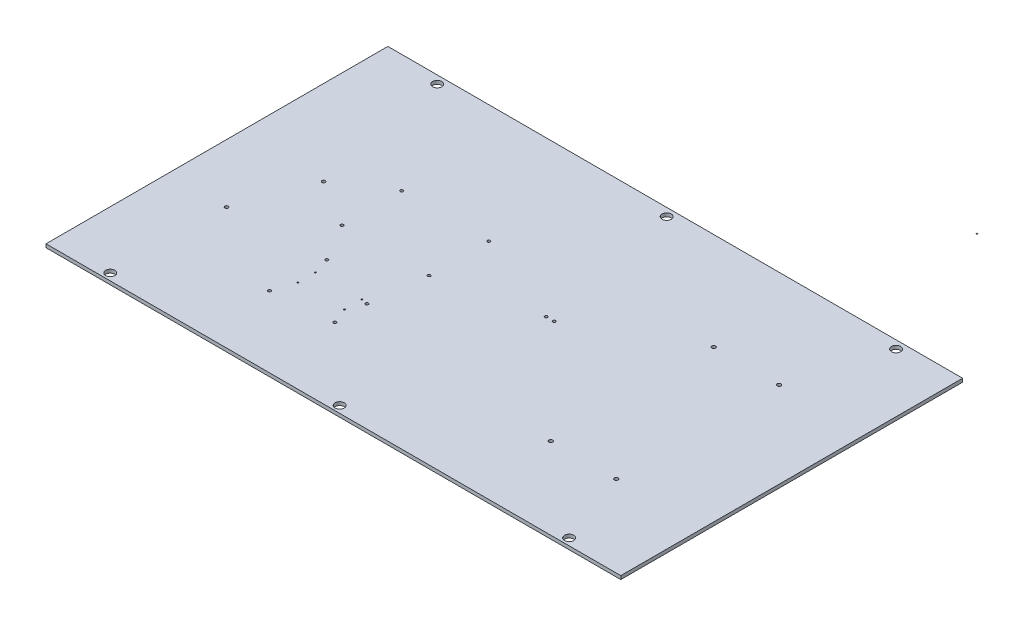
from build123d import *

# Parameters (mm, degrees)
SKETCH1_W                         = 1.001
SKETCH1_H                         = 1.001
SKETCH1_W_2                       = 0.001
SKETCH1_H_2                       = 0.001
EXTRUDE_THIN5_DEPTH               = 0.01
SKETCH2_W                         = 501
SKETCH2_H                         = 298
BOSS_EXTRUDE2_DEPTH               = 3
SKETCH35_W                        = 1.25
SKETCH35_H                        = 3
M3X0_5_TAPPED_HOLE3_AT_2_COUNT    = 2
M3X0_5_TAPPED_HOLE3_AT_2_PITCH    = 76
M3X0_5_TAPPED_HOLE3_AT_3_COUNT    = 2
M3X0_5_TAPPED_HOLE3_AT_3_PITCH    = 92.086915466
M3X0_5_TAPPED_HOLE3_AT_4_COUNT    = 2
M3X0_5_TAPPED_HOLE3_AT_4_PITCH    = 52
SKETCH37_W                        = 1.25
SKETCH37_H                        = 3
M3X0_5_TAPPED_HOLE2_AT_2_COUNT    = 2
M3X0_5_TAPPED_HOLE2_AT_2_PITCH    = 53.075229627
M3X0_5_TAPPED_HOLE2_AT_3_COUNT    = 2
M3X0_5_TAPPED_HOLE2_AT_3_PITCH    = 48.29
M3X0_5_TAPPED_HOLE2_AT_4_COUNT    = 2
M3X0_5_TAPPED_HOLE2_AT_4_PITCH    = 66.894989349
SKETCH39_W                        = 1.65
SKETCH39_H                        = 3
M4X0_7_TAPPED_HOLE1_AT_2_COUNT    = 2
M4X0_7_TAPPED_HOLE1_AT_2_PITCH    = 57
M4X0_7_TAPPED_HOLE1_AT_3_COUNT    = 2
M4X0_7_TAPPED_HOLE1_AT_3_PITCH    = 153.013071337
M4X0_7_TAPPED_HOLE1_AT_4_COUNT    = 2
M4X0_7_TAPPED_HOLE1_AT_4_PITCH    = 142
SKETCH40_W                        = 0.625
SKETCH40_H                        = 3
M1_6X0_35_TAPPED_HOLE1_AT_2_COUNT = 2
M1_6X0_35_TAPPED_HOLE1_AT_2_PITCH = 40.64
M1_6X0_35_TAPPED_HOLE1_AT_3_COUNT = 2
M1_6X0_35_TAPPED_HOLE1_AT_3_PITCH = 43.403539026
M1_6X0_35_TAPPED_HOLE1_AT_4_COUNT = 2
M1_6X0_35_TAPPED_HOLE1_AT_4_PITCH = 15.24
SKETCH42_W                        = 1.25
SKETCH42_H                        = 3
M3X0_5_TAPPED_HOLE1_AT_2_COUNT    = 2
M3X0_5_TAPPED_HOLE1_AT_2_PITCH    = 7
SKETCH49_W                        = 1.45
SKETCH49_H                        = 3
M3_5X0_6_TAPPED_HOLE1_AT_2_COUNT  = 2
M3_5X0_6_TAPPED_HOLE1_AT_2_PITCH  = 65.753783161
SKETCH55_W                        = 4
SKETCH55_H                        = 3.01
F_8_0MM_DOWEL_HOLE1_AT_2_COUNT    = 2
F_8_0MM_DOWEL_HOLE1_AT_2_PITCH    = 200
F_8_0MM_DOWEL_HOLE1_AT_3_COUNT    = 2
F_8_0MM_DOWEL_HOLE1_AT_3_PITCH    = 400
F_8_0MM_DOWEL_HOLE1_AT_4_COUNT    = 2
F_8_0MM_DOWEL_HOLE1_AT_4_PITCH    = 491.14661762
F_8_0MM_DOWEL_HOLE1_AT_5_COUNT    = 2
F_8_0MM_DOWEL_HOLE1_AT_5_PITCH    = 348.173807171
F_8_0MM_DOWEL_HOLE1_AT_6_COUNT    = 2
F_8_0MM_DOWEL_HOLE1_AT_6_PITCH    = 285


with BuildPart() as part:
    # Sketch1 → Extrude-Thin5 (new body)
    with BuildSketch(Plane(origin=(0, 0, 0), x_dir=(1, 0, 0), z_dir=(0, 1, 0))):
        with Locations((200.0005, 249.9995)):
            Rectangle(SKETCH1_W, SKETCH1_H)
        with Locations((200.0005, 249.9995)):
            Rectangle(SKETCH1_W_2, SKETCH1_H_2, mode=Mode.SUBTRACT)
    extrude(amount=EXTRUDE_THIN5_DEPTH)


with BuildPart() as body_2:
    # Sketch2 → Boss-Extrude2 (new body)
    with BuildSketch(Plane(origin=(0, 0, 0), x_dir=(1, 0, 0), z_dir=(0, 1, 0))):
        with Locations((52.411854103, -14.297492401)):
            Rectangle(SKETCH2_W, SKETCH2_H)
    extrude(amount=-BOSS_EXTRUDE2_DEPTH)

    # Sketch35 → M3x0.5 Tapped Hole3 (revolve, cut)
    with BuildSketch(Plane(origin=(-83.088145897, 0, -31.702507599), x_dir=(0, 0, 1), z_dir=(1, 0, 0))):
        with Locations((0.625, 1.5)):
            Rectangle(SKETCH35_W, SKETCH35_H)
    m3x0_5_tapped_hole3 = revolve(axis=Axis((-83.088145897, 6.35, -31.702507599), (0, -1, 0)), mode=Mode.SUBTRACT)

    # M3x0.5 Tapped Hole3 at 2: M3x0.5 Tapped Hole3 ×2
    with Locations(*[(i * M3X0_5_TAPPED_HOLE3_AT_2_PITCH, 0, 0) for i in range(1, M3X0_5_TAPPED_HOLE3_AT_2_COUNT)]):
        add(m3x0_5_tapped_hole3, mode=Mode.SUBTRACT)

    # M3x0.5 Tapped Hole3 at 3: M3x0.5 Tapped Hole3 ×2
    with Locations(*[Vector(0.8253072612498318, 0, 0.5646839155919902) * (i * M3X0_5_TAPPED_HOLE3_AT_3_PITCH) for i in range(1, M3X0_5_TAPPED_HOLE3_AT_3_COUNT)]):
        add(m3x0_5_tapped_hole3, mode=Mode.SUBTRACT)

    # M3x0.5 Tapped Hole3 at 4: M3x0.5 Tapped Hole3 ×2
    with Locations(*[(0, 0, i * M3X0_5_TAPPED_HOLE3_AT_4_PITCH) for i in range(1, M3X0_5_TAPPED_HOLE3_AT_4_COUNT)]):
        add(m3x0_5_tapped_hole3, mode=Mode.SUBTRACT)

    # Sketch37 → M3x0.5 Tapped Hole2 (revolve, cut)
    with BuildSketch(Plane(origin=(-63.588145897, 0, 53.037425058), x_dir=(0, 0, 1), z_dir=(1, 0, 0))):
        with Locations((0.625, 1.5)):
            Rectangle(SKETCH37_W, SKETCH37_H)
    m3x0_5_tapped_hole2 = revolve(axis=Axis((-63.588145897, 6.35, 53.037425058), (0, -1, 0)), mode=Mode.SUBTRACT)

    # M3x0.5 Tapped Hole2 at 2: M3x0.5 Tapped Hole2 ×2
    with Locations(*[Vector(0.9552478690330028, 0, 0.29580653932580175) * (i * M3X0_5_TAPPED_HOLE2_AT_2_PITCH) for i in range(1, M3X0_5_TAPPED_HOLE2_AT_2_COUNT)]):
        add(m3x0_5_tapped_hole2, mode=Mode.SUBTRACT)

    # M3x0.5 Tapped Hole2 at 3: M3x0.5 Tapped Hole2 ×2
    with Locations(*[Vector(-0.03520397597846292, 0, 0.9993801479293593) * (i * M3X0_5_TAPPED_HOLE2_AT_3_PITCH) for i in range(1, M3X0_5_TAPPED_HOLE2_AT_3_COUNT)]):
        add(m3x0_5_tapped_hole2, mode=Mode.SUBTRACT)

    # M3x0.5 Tapped Hole2 at 4: M3x0.5 Tapped Hole2 ×2
    with Locations(*[Vector(0.7579042988632139, 0, 0.6523657515264425) * (i * M3X0_5_TAPPED_HOLE2_AT_4_PITCH) for i in range(1, M3X0_5_TAPPED_HOLE2_AT_4_COUNT)]):
        add(m3x0_5_tapped_hole2, mode=Mode.SUBTRACT)

    # Sketch39 → M4x0.7 Tapped Hole1 (revolve, cut)
    with BuildSketch(Plane(origin=(227.911854103, 0, -49.702507599), x_dir=(0, 0, 1), z_dir=(1, 0, 0))):
        with Locations((0.825, 1.5)):
            Rectangle(SKETCH39_W, SKETCH39_H)
    m4x0_7_tapped_hole1 = revolve(axis=Axis((227.911854103, 6.35, -49.702507599), (0, -1, 0)), mode=Mode.SUBTRACT)

    # M4x0.7 Tapped Hole1 at 2: M4x0.7 Tapped Hole1 ×2
    with Locations(*[(-i * M4X0_7_TAPPED_HOLE1_AT_2_PITCH, 0, 0) for i in range(1, M4X0_7_TAPPED_HOLE1_AT_2_COUNT)]):
        add(m4x0_7_tapped_hole1, mode=Mode.SUBTRACT)

    # M4x0.7 Tapped Hole1 at 3: M4x0.7 Tapped Hole1 ×2
    with Locations(*[Vector(-0.3725171941319941, 0, 0.9280252906446173) * (i * M4X0_7_TAPPED_HOLE1_AT_3_PITCH) for i in range(1, M4X0_7_TAPPED_HOLE1_AT_3_COUNT)]):
        add(m4x0_7_tapped_hole1, mode=Mode.SUBTRACT)

    # M4x0.7 Tapped Hole1 at 4: M4x0.7 Tapped Hole1 ×2
    with Locations(*[(0, 0, i * M4X0_7_TAPPED_HOLE1_AT_4_PITCH) for i in range(1, M4X0_7_TAPPED_HOLE1_AT_4_COUNT)]):
        add(m4x0_7_tapped_hole1, mode=Mode.SUBTRACT)

    # Sketch40 → M1.6x0.35 Tapped Hole1 (revolve, cut)
    with BuildSketch(Plane(origin=(-18.448145897, 0, 82.797492401), x_dir=(0, 0, 1), z_dir=(1, 0, 0))):
        with Locations((0.3125, 1.5)):
            Rectangle(SKETCH40_W, SKETCH40_H)
    m1_6x0_35_tapped_hole1 = revolve(axis=Axis((-18.448145897, 6.35, 82.797492401), (0, -1, 0)), mode=Mode.SUBTRACT)

    # M1.6x0.35 Tapped Hole1 at 2: M1.6x0.35 Tapped Hole1 ×2
    with Locations(*[(-i * M1_6X0_35_TAPPED_HOLE1_AT_2_PITCH, 0, 0) for i in range(1, M1_6X0_35_TAPPED_HOLE1_AT_2_COUNT)]):
        add(m1_6x0_35_tapped_hole1, mode=Mode.SUBTRACT)

    # M1.6x0.35 Tapped Hole1 at 3: M1.6x0.35 Tapped Hole1 ×2
    with Locations(*[Vector(-0.9363291775690445, 0, -0.35112344158839176) * (i * M1_6X0_35_TAPPED_HOLE1_AT_3_PITCH) for i in range(1, M1_6X0_35_TAPPED_HOLE1_AT_3_COUNT)]):
        add(m1_6x0_35_tapped_hole1, mode=Mode.SUBTRACT)

    # M1.6x0.35 Tapped Hole1 at 4: M1.6x0.35 Tapped Hole1 ×2
    with Locations(*[(0, 0, -i * M1_6X0_35_TAPPED_HOLE1_AT_4_PITCH) for i in range(1, M1_6X0_35_TAPPED_HOLE1_AT_4_COUNT)]):
        add(m1_6x0_35_tapped_hole1, mode=Mode.SUBTRACT)

    # Sketch42 → M3x0.5 Tapped Hole1 (revolve, cut)
    with BuildSketch(Plane(origin=(81.911854103, 0, 0.297492401), x_dir=(0, 0, 1), z_dir=(1, 0, 0))):
        with Locations((0.625, 1.5)):
            Rectangle(SKETCH42_W, SKETCH42_H)
    m3x0_5_tapped_hole1 = revolve(axis=Axis((81.911854103, 6.35, 0.297492401), (0, -1, 0)), mode=Mode.SUBTRACT)

    # M3x0.5 Tapped Hole1 at 2: M3x0.5 Tapped Hole1 ×2
    with Locations(*[(-i * M3X0_5_TAPPED_HOLE1_AT_2_PITCH, 0, 0) for i in range(1, M3X0_5_TAPPED_HOLE1_AT_2_COUNT)]):
        add(m3x0_5_tapped_hole1, mode=Mode.SUBTRACT)

    # Sketch49 → M3.5x0.6 Tapped Hole1 (revolve, cut)
    with BuildSketch(Plane(origin=(-124.088145897, 0, -4.702507599), x_dir=(0, 0, 1), z_dir=(1, 0, 0))):
        with Locations((0.725, 1.5)):
            Rectangle(SKETCH49_W, SKETCH49_H)
    m3_5x0_6_tapped_hole1 = revolve(axis=Axis((-124.088145897, 6.35, -4.702507599), (0, -1, 0)), mode=Mode.SUBTRACT)

    # M3.5x0.6 Tapped Hole1 at 2: M3.5x0.6 Tapped Hole1 ×2
    with Locations(*[Vector(-0.34978975952822045, 0, 0.9368282255190595) * (i * M3_5X0_6_TAPPED_HOLE1_AT_2_PITCH) for i in range(1, M3_5X0_6_TAPPED_HOLE1_AT_2_COUNT)]):
        add(m3_5x0_6_tapped_hole1, mode=Mode.SUBTRACT)

    # Sketch55 → Ø8.0mm Dowel Hole1 (revolve, cut)
    with BuildSketch(Plane(origin=(-148.088145897, -3, 157.297492401), x_dir=(0, 0, -1), z_dir=(1, 0, 0))):
        with Locations((2, 1.505)):
            Rectangle(SKETCH55_W, SKETCH55_H)
    f_8_0mm_dowel_hole1 = revolve(axis=Axis((-148.088145897, -9.35, 157.297492401), (0, 1, 0)), mode=Mode.SUBTRACT)

    # Ø8.0mm Dowel Hole1 at 2: Ø8.0mm Dowel Hole1 ×2
    with Locations(*[(i * F_8_0MM_DOWEL_HOLE1_AT_2_PITCH, 0, 0) for i in range(1, F_8_0MM_DOWEL_HOLE1_AT_2_COUNT)]):
        add(f_8_0mm_dowel_hole1, mode=Mode.SUBTRACT)

    # Ø8.0mm Dowel Hole1 at 3: Ø8.0mm Dowel Hole1 ×2
    with Locations(*[(i * F_8_0MM_DOWEL_HOLE1_AT_3_PITCH, 0, 0) for i in range(1, F_8_0MM_DOWEL_HOLE1_AT_3_COUNT)]):
        add(f_8_0mm_dowel_hole1, mode=Mode.SUBTRACT)

    # Ø8.0mm Dowel Hole1 at 4: Ø8.0mm Dowel Hole1 ×2
    with Locations(*[Vector(0.8144207567547996, 0, -0.5802747891877947) * (i * F_8_0MM_DOWEL_HOLE1_AT_4_PITCH) for i in range(1, F_8_0MM_DOWEL_HOLE1_AT_4_COUNT)]):
        add(f_8_0mm_dowel_hole1, mode=Mode.SUBTRACT)

    # Ø8.0mm Dowel Hole1 at 5: Ø8.0mm Dowel Hole1 ×2
    with Locations(*[Vector(0.5744257490964302, 0, -0.8185566924624129) * (i * F_8_0MM_DOWEL_HOLE1_AT_5_PITCH) for i in range(1, F_8_0MM_DOWEL_HOLE1_AT_5_COUNT)]):
        add(f_8_0mm_dowel_hole1, mode=Mode.SUBTRACT)

    # Ø8.0mm Dowel Hole1 at 6: Ø8.0mm Dowel Hole1 ×2
    with Locations(*[(0, 0, -i * F_8_0MM_DOWEL_HOLE1_AT_6_PITCH) for i in range(1, F_8_0MM_DOWEL_HOLE1_AT_6_COUNT)]):
        add(f_8_0mm_dowel_hole1, mode=Mode.SUBTRACT)


solid = Compound([part.part, body_2.part])
